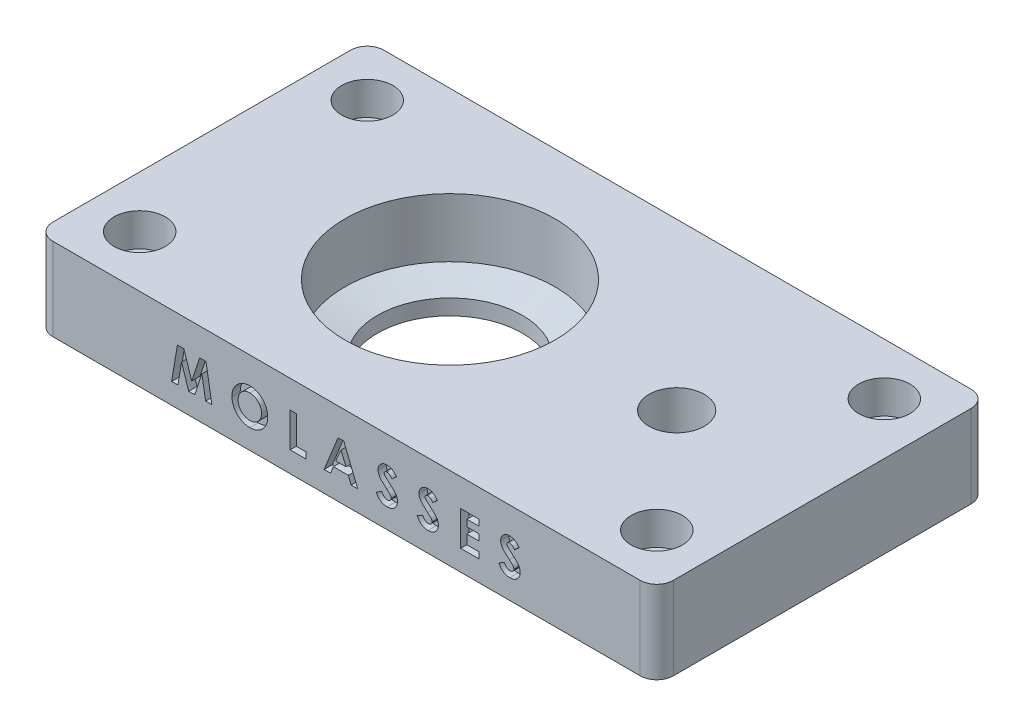
from build123d import *

# Parameters (mm, degrees)
SKETCH1_W           = 95.25
SKETCH1_H           = 50.8
BOSS_EXTRUDE1_DEPTH = 12.7
SKETCH4_R           = 2.54
CUT_EXTRUDE3_DEPTH  = 64.816710194
FILLET2_R           = 2.54
SKETCH8_R           = 4.25
CUT_EXTRUDE4_DEPTH  = 6.35
CUT_EXTRUDE5_DEPTH  = 1.27
SKETCH10_R          = 3.937
CUT_EXTRUDE6_DEPTH  = 5.08


with BuildPart() as part:
    # Sketch1 → Boss-Extrude1 (new body)
    with BuildSketch(Plane(origin=(0, 0, 0), x_dir=(1, 0, 0), z_dir=(0, 1, 0))):
        with Locations((9.525, 0)):
            Rectangle(SKETCH1_W, SKETCH1_H)
    extrude(amount=BOSS_EXTRUDE1_DEPTH)

    # Sketch4 → Cut-Extrude3 (cut, through all)
    with BuildSketch(Plane(origin=(0, 12.7, 0), x_dir=(1, 0, 0), z_dir=(0, 1, 0))):
        with Locations(Location((-30.1625, 17.4625, 0), (0, 0, 270))):
            Circle(SKETCH4_R)
        with Locations(Location((49.2125, 17.4625, 0), (0, 0, 270))):
            Circle(SKETCH4_R)
        with Locations(Location((49.2125, -17.4625, 0), (0, 0, 270))):
            Circle(SKETCH4_R)
        with Locations(Location((-30.1625, -17.4625, 0), (0, 0, 270))):
            Circle(SKETCH4_R)
    extrude(amount=-CUT_EXTRUDE3_DEPTH, mode=Mode.SUBTRACT)

    # Fillet2
    fillet2_edges = [part.edges().sort_by_distance(p)[0] for p in [
        (57.15, 6.35, 25.4),
        (-38.1, 6.35, 25.4),
        (-38.1, 6.35, -25.4),
        (57.15, 6.35, -25.4),
    ]]
    fillet(fillet2_edges, radius=FILLET2_R)

    # Sketch6 → Cut-Revolve1 (revolve, cut)
    with BuildSketch(Plane.XY, mode=Mode.PRIVATE) as cut_revolve1_sk:
        Polygon((0, 0), (0, 12.7), (-16.129, 12.7), (-16.129, 3.65125), (-11.1125, 2.38125), (-11.1125, 0), align=None)
    revolve(cut_revolve1_sk.sketch.rotate(Axis((0, 0, 0), (0, 1, 0)), 180), axis=Axis((0, 0, 0), (0, 1, 0)), mode=Mode.SUBTRACT)

    # Sketch8 → Cut-Extrude4 (cut)
    with BuildSketch(Plane(origin=(0, 12.7, 0), x_dir=(1, 0, 0), z_dir=(0, 1, 0))):
        with Locations(Location((34.798, 0, 0), (0, 0, 270))):
            Circle(SKETCH8_R)
    extrude(amount=-CUT_EXTRUDE4_DEPTH, mode=Mode.SUBTRACT)

    # Sketch9 → Cut-Extrude5 (cut)
    # profile 1 of 8: a face of its own
    with BuildSketch(Plane.XY.offset(25.4)):
        Polygon((-16.429819378, 8.466666667), (-15.443992054, 8.466666667), (-14.23661859, 4.775644364), (-13.02076489, 8.466666667), (-12.044477831, 8.466666667), (-11.149813034, 3.175), (-12.111259682, 3.175), (-12.676255342, 6.517272636), (-13.776565839, 3.175), (-14.703031517, 3.175), (-15.796981838, 6.517272636), (-16.360917468, 3.175), (-17.323424145, 3.175), align=None)
    # profile 2 of 8: a face of its own
    with BuildSketch(Plane.XY.offset(25.4)):
        with BuildLine():
            add(Edge.make_bspline(
                [(-5.304811031, 8.602350427), (-5.212808921, 8.599968328), (-5.031175917, 8.595265524), (-4.764059313, 8.556063985), (-4.506643075, 8.492190696), (-4.259043607, 8.403402205), (-4.021880869, 8.287293668), (-3.794318308, 8.147156839), (-3.577171042, 7.980346718), (-3.372664224, 7.79075471), (-3.18366304, 7.58458168), (-3.019893404, 7.362599759), (-2.880236666, 7.13056072), (-2.764488788, 6.88784281), (-2.676325235, 6.63276509), (-2.614457223, 6.366628119), (-2.574710091, 6.089507612), (-2.570138559, 5.900826319), (-2.567815171, 5.804932893)],
                knots=[0, 0, 0, 0, 1.014329547, 2.002516266, 2.970391464, 3.935626869, 4.897733899, 5.877609409, 6.878433252, 7.912639331, 8.949961323, 9.958554974, 10.949718813, 11.932905612, 12.9188844, 13.919928257, 14.942845884, 16, 16, 16, 16], degree=3))
            add(Edge.make_bspline(
                [(-2.567815171, 5.804932893), (-2.570289479, 5.710119964), (-2.575165181, 5.523288046), (-2.612834571, 5.248721313), (-2.675744448, 4.985435224), (-2.762412678, 4.732833825), (-2.876061327, 4.49214063), (-3.012994607, 4.261818846), (-3.176825925, 4.044005916), (-3.361579711, 3.838818724), (-3.564977596, 3.65256732), (-3.780408245, 3.488433591), (-4.006876932, 3.349352864), (-4.244052181, 3.235388843), (-4.492442601, 3.146945563), (-4.751434637, 3.084542403), (-5.021012265, 3.046618743), (-5.204338124, 3.041774888), (-5.297390825, 3.039316239)],
                knots=[0, 0, 0, 0, 1.051557043, 2.072126891, 3.067553643, 4.050577992, 5.02905126, 6.015227836, 7.017913613, 8.04756643, 9.074058332, 10.072836633, 11.047628519, 12.017157415, 12.98668631, 13.966869689, 14.968021931, 16, 16, 16, 16], degree=3))
            add(Edge.make_bspline(
                [(-5.297390825, 3.039316239), (-5.394712793, 3.041521768), (-5.585937157, 3.04585533), (-5.865794869, 3.087065529), (-6.133922739, 3.149142484), (-6.388068338, 3.241789009), (-6.630819923, 3.357604956), (-6.860393925, 3.500239239), (-7.076713193, 3.669456142), (-7.278536884, 3.860921959), (-7.461389637, 4.070427558), (-7.622793059, 4.291751644), (-7.758940425, 4.523203496), (-7.869836718, 4.764891439), (-7.9572629, 5.015313441), (-8.018932138, 5.275994643), (-8.055361629, 5.546309839), (-8.060436046, 5.729913323), (-8.063007479, 5.822953392)],
                knots=[0, 0, 0, 0, 1.067978421, 2.098431617, 3.099715153, 4.085208694, 5.062210972, 6.048429807, 7.046490867, 8.072918869, 9.098532598, 10.095778865, 11.076610158, 12.041847152, 13.011192615, 13.984257998, 14.978533688, 16, 16, 16, 16], degree=3))
            add(Edge.make_bspline(
                [(-8.063007479, 5.822953392), (-8.062200415, 5.88554588), (-8.060596506, 6.00993829), (-8.041275741, 6.194281493), (-8.013459393, 6.375026564), (-7.972320335, 6.55145287), (-7.922346894, 6.724805016), (-7.857599242, 6.893469398), (-7.783898891, 7.059247816), (-7.697786971, 7.220182218), (-7.602038842, 7.374791873), (-7.497569108, 7.522347462), (-7.384115083, 7.66106482), (-7.262042238, 7.791855542), (-7.130929894, 7.91385993), (-6.992502699, 8.028805127), (-6.844075971, 8.133637779), (-6.688898306, 8.230918109), (-6.527844559, 8.318887024), (-6.361570366, 8.393763534), (-6.193501303, 8.459151915), (-6.021392194, 8.510759316), (-5.847087494, 8.552793004), (-5.668725111, 8.580590604), (-5.487916448, 8.599910834), (-5.365991019, 8.6015353), (-5.304811031, 8.602350427)],
                knots=[0, 0, 0, 0, 1.034744296, 2.056386356, 3.06226378, 4.057406941, 5.050368692, 6.043467995, 7.042652155, 8.049140477, 9.059438543, 10.048523776, 11.036952808, 12.020949711, 13.004946614, 13.997082645, 14.994316842, 16.007702937, 17.024872941, 18.026463647, 19.021641123, 20.005082605, 20.995858141, 21.984425357, 22.988620895, 24, 24, 24, 24], degree=3))
        make_face()
        with BuildLine():
            add(Edge.make_bspline(
                [(-5.319651442, 7.652564103), (-5.38156885, 7.650902719), (-5.503769037, 7.647623814), (-5.683014455, 7.62264299), (-5.855096388, 7.582745774), (-6.019060915, 7.524955145), (-6.175618674, 7.451402342), (-6.325047193, 7.362344366), (-6.465277196, 7.25471995), (-6.598178514, 7.134306969), (-6.718232986, 7.000139235), (-6.824304899, 6.85635569), (-6.913070006, 6.703196451), (-6.987411339, 6.542084331), (-7.043373886, 6.371207667), (-7.083234331, 6.191904953), (-7.108424644, 6.003867243), (-7.111599914, 5.87568218), (-7.113221154, 5.81023304)],
                knots=[0, 0, 0, 0, 1.033739768, 2.040188636, 3.016340934, 3.979330865, 4.937572243, 5.900995986, 6.878200029, 7.884839167, 8.891893314, 9.879764717, 10.863503415, 11.843163062, 12.837761627, 13.859916423, 14.907309254, 16, 16, 16, 16], degree=3))
            add(Edge.make_bspline(
                [(-7.113221154, 5.81023304), (-7.111071638, 5.737700669), (-7.106858942, 5.595549241), (-7.077217902, 5.388182567), (-7.026505033, 5.192345325), (-6.953276636, 5.008995325), (-6.862454212, 4.836096603), (-6.749667176, 4.675768278), (-6.616742144, 4.527050379), (-6.514337777, 4.440222675), (-6.462363114, 4.396153846)],
                knots=[0, 0, 0, 0, 1.078454662, 2.113592447, 3.107694534, 4.079536787, 5.043276885, 6.005368276, 6.987637804, 8, 8, 8, 8], degree=3))
            add(Edge.make_bspline(
                [(-6.462363114, 4.396153846), (-6.419785943, 4.363597488), (-6.335590872, 4.299218271), (-6.201197207, 4.216703098), (-6.062798196, 4.145979363), (-5.919349444, 4.088835422), (-5.771153908, 4.043886959), (-5.61823191, 4.012410289), (-5.460800128, 3.992655956), (-5.354337378, 3.990294939), (-5.300570913, 3.989102564)],
                knots=[0, 0, 0, 0, 1.023928204, 2.024787132, 3.009472467, 3.9914905, 4.972207045, 5.96565515, 6.972602802, 8, 8, 8, 8], degree=3))
            add(Edge.make_bspline(
                [(-5.300570913, 3.989102564), (-5.239718177, 3.990778034), (-5.119988503, 3.994074573), (-4.944079835, 4.01874787), (-4.775553988, 4.060503996), (-4.613364739, 4.117787665), (-4.45797977, 4.192263988), (-4.31015849, 4.284084263), (-4.169641728, 4.392121054), (-4.036909724, 4.514115322), (-3.915586398, 4.648811584), (-3.809735835, 4.793362055), (-3.718148441, 4.944581855), (-3.645353037, 5.104611272), (-3.587179536, 5.271939703), (-3.547798833, 5.447308209), (-3.522395719, 5.629993855), (-3.519219554, 5.754317893), (-3.517601496, 5.817653245)],
                knots=[0, 0, 0, 0, 1.026359118, 2.019393844, 2.989460624, 3.950973911, 4.916101784, 5.890408035, 6.881132271, 7.902007068, 8.92769091, 9.933912415, 10.920395702, 11.90457117, 12.894218921, 13.903490204, 14.931958862, 16, 16, 16, 16], degree=3))
            add(Edge.make_bspline(
                [(-3.517601496, 5.817653245), (-3.519275539, 5.880624402), (-3.522570638, 6.00457352), (-3.547287361, 6.186789482), (-3.58877868, 6.361383788), (-3.646234366, 6.528641568), (-3.719602235, 6.688726796), (-3.810329048, 6.841076519), (-3.918096455, 6.985543452), (-4.040424197, 7.121143108), (-4.173570426, 7.245750506), (-4.316516207, 7.353887076), (-4.465261755, 7.447854317), (-4.623220021, 7.521464459), (-4.78715931, 7.580109503), (-4.958079987, 7.623296555), (-5.136629427, 7.647448323), (-5.258100303, 7.650843642), (-5.319651442, 7.652564103)],
                knots=[0, 0, 0, 0, 1.055025985, 2.07665775, 3.074803781, 4.057872707, 5.035505728, 6.020516407, 7.023567878, 8.050795229, 9.077271434, 10.074415901, 11.050397877, 12.019801805, 12.988065821, 13.964604439, 14.968634123, 16, 16, 16, 16], degree=3))
        make_face(mode=Mode.SUBTRACT)
    # profile 3 of 8: a face of its own
    with BuildSketch(Plane.XY.offset(25.4)):
        Polygon((0.858199786, 8.466666667), (1.807986111, 8.466666667), (1.807986111, 4.124786325), (3.300507479, 4.124786325), (3.300507479, 3.175), (0.858199786, 3.175), align=None)
    # profile 4 of 8: a face of its own
    with BuildSketch(Plane.XY.offset(25.4)):
        Polygon((8.220103833, 8.466666667), (9.100988248, 8.466666667), (11.238007479, 3.175), (10.223559362, 3.175), (9.812267962, 4.260470085), (7.50670406, 4.260470085), (7.09541266, 3.175), (6.082024573, 3.175), align=None)
        Polygon((8.660016026, 7.047287326), (7.867114049, 5.21025641), (9.452918002, 5.21025641), align=None, mode=Mode.SUBTRACT)
    # profile 5 of 8: a face of its own
    with BuildSketch(Plane.XY.offset(25.4)):
        with BuildLine():
            Line((17.208092949, 7.75962707), (16.497873264, 7.10982906))
            add(Edge.make_bspline(
                [(16.497873264, 7.10982906), (16.467450498, 7.152743534), (16.40904303, 7.23513334), (16.314370616, 7.345455231), (16.220125697, 7.439568015), (16.125435151, 7.517078531), (16.029459676, 7.577515845), (15.932365872, 7.620306131), (15.834704191, 7.647508322), (15.769090617, 7.65089565), (15.736772169, 7.652564103)],
                knots=[0, 0, 0, 0, 1.299362458, 2.494594718, 3.587462134, 4.587049575, 5.512617175, 6.380583204, 7.202344345, 8, 8, 8, 8], degree=3))
            add(Edge.make_bspline(
                [(15.736772169, 7.652564103), (15.706626447, 7.651506894), (15.648422979, 7.649465703), (15.565449616, 7.629176411), (15.491784683, 7.594160073), (15.427500074, 7.548373266), (15.376577179, 7.493210778), (15.335919196, 7.435359512), (15.313025335, 7.371504798), (15.310012053, 7.327646804), (15.308520299, 7.305934495)],
                knots=[0, 0, 0, 0, 1.185010067, 2.2879431, 3.333075148, 4.379039566, 5.372662701, 6.27520591, 7.14612461, 8, 8, 8, 8], degree=3))
            add(Edge.make_bspline(
                [(15.308520299, 7.305934495), (15.309455106, 7.283909085), (15.311337676, 7.239552971), (15.32952074, 7.174543561), (15.35692781, 7.1110218), (15.383116385, 7.072353082), (15.396502738, 7.052587473)],
                knots=[0, 0, 0, 0, 0.967525499, 1.948461899, 2.951351359, 4, 4, 4, 4], degree=3))
            add(Edge.make_bspline(
                [(15.396502738, 7.052587473), (15.408672381, 7.037223873), (15.436685291, 7.001858893), (15.490100175, 6.945846277), (15.55717805, 6.87722592), (15.640500215, 6.798357475), (15.736607739, 6.706404524), (15.849955327, 6.604981772), (15.977280343, 6.490948275), (16.067780015, 6.411539477), (16.115202658, 6.369928552)],
                knots=[0, 0, 0, 0, 0.473873513, 1.090794244, 1.870441696, 2.795289791, 3.865433203, 5.087734844, 6.473946851, 8, 8, 8, 8], degree=3))
            add(Edge.make_bspline(
                [(16.115202658, 6.369928552), (16.159715629, 6.331404821), (16.244192001, 6.258294782), (16.364385103, 6.15452682), (16.470014822, 6.061169315), (16.562619941, 5.979623363), (16.640796658, 5.90903336), (16.704873627, 5.849061888), (16.755633441, 5.80087648), (16.784487423, 5.771772464), (16.796801549, 5.759351629)],
                knots=[0, 0, 0, 0, 1.543621617, 2.929473131, 4.163658386, 5.240097082, 6.164993805, 6.925417477, 7.541396219, 8, 8, 8, 8], degree=3))
            add(Edge.make_bspline(
                [(16.796801549, 5.759351629), (16.843518778, 5.708793582), (16.933325698, 5.611603261), (17.050043036, 5.460988828), (17.14610518, 5.313958431), (17.220420676, 5.167745453), (17.276546728, 5.020240334), (17.316116338, 4.867825517), (17.339814841, 4.708908364), (17.342445928, 4.600466807), (17.343776709, 4.545617989)],
                knots=[0, 0, 0, 0, 1.206664779, 2.319633467, 3.337109185, 4.282041471, 5.190008762, 6.099243693, 7.03861361, 8, 8, 8, 8], degree=3))
            add(Edge.make_bspline(
                [(17.343776709, 4.545617989), (17.342829493, 4.492174542), (17.34097102, 4.387316511), (17.318208284, 4.233872401), (17.285749959, 4.087019728), (17.235563695, 3.948356457), (17.174396972, 3.815606473), (17.097715652, 3.690837598), (17.007663956, 3.57278712), (16.904450885, 3.463565336), (16.790284973, 3.364454137), (16.667831182, 3.276223007), (16.535892098, 3.20337697), (16.395594987, 3.143393455), (16.247014947, 3.09719335), (16.090328981, 3.063047167), (15.925297428, 3.042553165), (15.812446474, 3.040410761), (15.754792668, 3.039316239)],
                knots=[0, 0, 0, 0, 1.043214005, 2.046824704, 3.02475056, 3.976699089, 4.921714032, 5.875962561, 6.831408892, 7.817874052, 8.806269674, 9.781291748, 10.760897367, 11.74438705, 12.757449933, 13.795994037, 14.874007457, 16, 16, 16, 16], degree=3))
            add(Edge.make_bspline(
                [(15.754792668, 3.039316239), (15.709534921, 3.040119142), (15.619898627, 3.041709349), (15.487788281, 3.054692071), (15.360220808, 3.075644801), (15.2373399, 3.105676324), (15.118591959, 3.143730335), (15.003972106, 3.190211853), (14.894271602, 3.245841323), (14.788660399, 3.309474781), (14.687651899, 3.383361609), (14.589968889, 3.465991213), (14.49658165, 3.558634474), (14.40704166, 3.661072295), (14.321921823, 3.773594754), (14.238435861, 3.894634769), (14.16029414, 4.026438677), (14.112022523, 4.118900185), (14.087366453, 4.166127471)],
                knots=[0, 0, 0, 0, 1.016823716, 2.013894106, 2.979844003, 3.91962641, 4.853723003, 5.779685073, 6.695824784, 7.614987388, 8.547259901, 9.504950863, 10.487499108, 11.500346958, 12.559593716, 13.656357062, 14.802919212, 16, 16, 16, 16], degree=3))
            Line((14.087366453, 4.166127471), (14.922669605, 4.667521368))
            add(Edge.make_bspline(
                [(14.922669605, 4.667521368), (14.953510664, 4.613912228), (15.012635609, 4.511138925), (15.112828358, 4.373049966), (15.215470713, 4.254799632), (15.322935675, 4.158478003), (15.43391651, 4.082797135), (15.548949281, 4.028710337), (15.668114808, 3.99523067), (15.749284952, 3.991142029), (15.789773638, 3.989102564)],
                knots=[0, 0, 0, 0, 1.283663364, 2.460892379, 3.537111102, 4.529833553, 5.449777664, 6.316464042, 7.160231139, 8, 8, 8, 8], degree=3))
            add(Edge.make_bspline(
                [(15.789773638, 3.989102564), (15.830956428, 3.990768102), (15.910857039, 3.993999488), (16.024904937, 4.023846827), (16.129468369, 4.070709339), (16.219852226, 4.137575682), (16.296383578, 4.214749604), (16.352868109, 4.300609121), (16.388352072, 4.393507046), (16.392103587, 4.458040055), (16.393990385, 4.490496461)],
                knots=[0, 0, 0, 0, 1.13588714, 2.203786484, 3.234766741, 4.283437687, 5.291419208, 6.222934724, 7.106237994, 8, 8, 8, 8], degree=3))
            add(Edge.make_bspline(
                [(16.393990385, 4.490496461), (16.392248005, 4.520691865), (16.388708527, 4.582030938), (16.362637822, 4.673232275), (16.321881358, 4.764392136), (16.273663587, 4.83916392), (16.224595968, 4.901768309), (16.177676257, 4.956012179), (16.12054046, 5.015942159), (16.05333345, 5.081633637), (15.976943205, 5.153664911), (15.891305377, 5.232028927), (15.795439323, 5.316035393), (15.727681006, 5.373259767), (15.692250935, 5.403181757)],
                knots=[0, 0, 0, 0, 0.916159276, 1.861089862, 2.860218735, 3.940849679, 4.552606315, 5.27541173, 6.11797699, 7.06649574, 8.129236253, 9.306560635, 10.591630461, 12, 12, 12, 12], degree=3))
            add(Edge.make_bspline(
                [(15.692250935, 5.403181757), (15.624896959, 5.46016968), (15.495624293, 5.569546752), (15.312945614, 5.731093244), (15.148335768, 5.882073243), (15.003216502, 6.024353192), (14.875738771, 6.15530551), (14.766765911, 6.275993842), (14.677495038, 6.387349133), (14.583556693, 6.519242024), (14.494296483, 6.679962574), (14.417150332, 6.873328027), (14.367101166, 7.066668945), (14.361493853, 7.196467388), (14.358733974, 7.260353232)],
                knots=[0, 0, 0, 0, 1.345494975, 2.582412109, 3.71882943, 4.751509156, 5.681369928, 6.505683931, 7.230279997, 7.856715994, 8.973648664, 10.023341002, 11.027102913, 12, 12, 12, 12], degree=3))
            add(Edge.make_bspline(
                [(14.358733974, 7.260353232), (14.359881804, 7.305657643), (14.362143152, 7.3949122), (14.382314724, 7.52614802), (14.412461908, 7.652779561), (14.456244273, 7.774344811), (14.513068496, 7.890691505), (14.582079308, 8.00238921), (14.664348316, 8.108409885), (14.757059934, 8.208683246), (14.8592044, 8.300321687), (14.968358743, 8.381201793), (15.083905139, 8.449514307), (15.205136734, 8.506184498), (15.33280475, 8.549561929), (15.465968662, 8.580310014), (15.60481947, 8.598597994), (15.699262793, 8.601084033), (15.747372463, 8.602350427)],
                knots=[0, 0, 0, 0, 1.010766082, 1.991317756, 2.957454644, 3.913069143, 4.869106762, 5.843196583, 6.838735724, 7.860187025, 8.887984031, 9.89767229, 10.887916223, 11.879572884, 12.879850636, 13.892031539, 14.926195476, 16, 16, 16, 16], degree=3))
            add(Edge.make_bspline(
                [(15.747372463, 8.602350427), (15.809720214, 8.600069614), (15.933923565, 8.595525991), (16.117561801, 8.559996342), (16.296931953, 8.504122227), (16.441471782, 8.436716254), (16.556479427, 8.371420057), (16.644622043, 8.311303543), (16.7343119, 8.242436846), (16.82627229, 8.164602948), (16.918794446, 8.076335356), (17.014509217, 7.97973535), (17.112112371, 7.87396808), (17.175538946, 7.798408432), (17.208092949, 7.75962707)],
                knots=[0, 0, 0, 0, 1.282922637, 2.555718331, 3.837320111, 5.142675274, 5.830281639, 6.55870424, 7.337177975, 8.157850921, 9.037902056, 9.96903443, 10.957596896, 12, 12, 12, 12], degree=3))
        make_face()
    # profile 6 of 8: a face of its own
    with BuildSketch(Plane.XY.offset(25.4)):
        with BuildLine():
            Line((23.48346688, 7.75962707), (22.773247196, 7.10982906))
            add(Edge.make_bspline(
                [(22.773247196, 7.10982906), (22.74282443, 7.152743534), (22.684416962, 7.23513334), (22.589744548, 7.345455231), (22.495499629, 7.439568015), (22.400809082, 7.517078531), (22.304833608, 7.577515845), (22.207739804, 7.620306131), (22.110078123, 7.647508322), (22.044464549, 7.65089565), (22.0121461, 7.652564103)],
                knots=[0, 0, 0, 0, 1.299362458, 2.494594718, 3.587462134, 4.587049575, 5.512617175, 6.380583204, 7.202344345, 8, 8, 8, 8], degree=3))
            add(Edge.make_bspline(
                [(22.0121461, 7.652564103), (21.982000379, 7.651506894), (21.92379691, 7.649465703), (21.840823548, 7.629176411), (21.767158615, 7.594160073), (21.702874006, 7.548373266), (21.65195111, 7.493210778), (21.611293128, 7.435359512), (21.588399267, 7.371504798), (21.585385984, 7.327646804), (21.583894231, 7.305934495)],
                knots=[0, 0, 0, 0, 1.185010067, 2.2879431, 3.333075148, 4.379039566, 5.372662701, 6.27520591, 7.14612461, 8, 8, 8, 8], degree=3))
            add(Edge.make_bspline(
                [(21.583894231, 7.305934495), (21.584829037, 7.283909085), (21.586711607, 7.239552971), (21.604894672, 7.174543561), (21.632301742, 7.1110218), (21.658490316, 7.072353082), (21.671876669, 7.052587473)],
                knots=[0, 0, 0, 0, 0.967525499, 1.948461899, 2.951351359, 4, 4, 4, 4], degree=3))
            add(Edge.make_bspline(
                [(21.671876669, 7.052587473), (21.684046312, 7.037223873), (21.712059223, 7.001858893), (21.765474106, 6.945846277), (21.832551982, 6.87722592), (21.915874147, 6.798357475), (22.01198167, 6.706404524), (22.125329259, 6.604981772), (22.252654275, 6.490948275), (22.343153947, 6.411539477), (22.390576589, 6.369928552)],
                knots=[0, 0, 0, 0, 0.473873513, 1.090794244, 1.870441696, 2.795289791, 3.865433203, 5.087734844, 6.473946851, 8, 8, 8, 8], degree=3))
            add(Edge.make_bspline(
                [(22.390576589, 6.369928552), (22.435089561, 6.331404821), (22.519565933, 6.258294782), (22.639759035, 6.15452682), (22.745388754, 6.061169315), (22.837993873, 5.979623363), (22.91617059, 5.90903336), (22.980247559, 5.849061888), (23.031007372, 5.80087648), (23.059861354, 5.771772464), (23.072175481, 5.759351629)],
                knots=[0, 0, 0, 0, 1.543621617, 2.929473131, 4.163658386, 5.240097082, 6.164993805, 6.925417477, 7.541396219, 8, 8, 8, 8], degree=3))
            add(Edge.make_bspline(
                [(23.072175481, 5.759351629), (23.11889271, 5.708793582), (23.20869963, 5.611603261), (23.325416967, 5.460988828), (23.421479112, 5.313958431), (23.495794608, 5.167745453), (23.55192066, 5.020240334), (23.59149027, 4.867825517), (23.615188772, 4.708908364), (23.61781986, 4.600466807), (23.619150641, 4.545617989)],
                knots=[0, 0, 0, 0, 1.206664779, 2.319633467, 3.337109185, 4.282041471, 5.190008762, 6.099243693, 7.03861361, 8, 8, 8, 8], degree=3))
            add(Edge.make_bspline(
                [(23.619150641, 4.545617989), (23.618203425, 4.492174542), (23.616344951, 4.387316511), (23.593582216, 4.233872401), (23.561123891, 4.087019728), (23.510937626, 3.948356457), (23.449770904, 3.815606473), (23.373089584, 3.690837598), (23.283037888, 3.57278712), (23.179824817, 3.463565336), (23.065658905, 3.364454137), (22.943205114, 3.276223007), (22.81126603, 3.20337697), (22.670968918, 3.143393455), (22.522388878, 3.09719335), (22.365702913, 3.063047167), (22.20067136, 3.042553165), (22.087820406, 3.040410761), (22.0301666, 3.039316239)],
                knots=[0, 0, 0, 0, 1.043214005, 2.046824704, 3.02475056, 3.976699089, 4.921714032, 5.875962561, 6.831408892, 7.817874052, 8.806269674, 9.781291748, 10.760897367, 11.74438705, 12.757449933, 13.795994037, 14.874007457, 16, 16, 16, 16], degree=3))
            add(Edge.make_bspline(
                [(22.0301666, 3.039316239), (21.984908853, 3.040119142), (21.895272559, 3.041709349), (21.763162213, 3.054692071), (21.635594739, 3.075644801), (21.512713832, 3.105676324), (21.39396589, 3.143730335), (21.279346038, 3.190211853), (21.169645533, 3.245841323), (21.064034331, 3.309474781), (20.963025831, 3.383361609), (20.865342821, 3.465991213), (20.771955581, 3.558634474), (20.682415592, 3.661072295), (20.597295755, 3.773594754), (20.513809792, 3.894634769), (20.435668072, 4.026438677), (20.387396455, 4.118900185), (20.362740385, 4.166127471)],
                knots=[0, 0, 0, 0, 1.016823716, 2.013894106, 2.979844003, 3.91962641, 4.853723003, 5.779685073, 6.695824784, 7.614987388, 8.547259901, 9.504950863, 10.487499108, 11.500346958, 12.559593716, 13.656357062, 14.802919212, 16, 16, 16, 16], degree=3))
            Line((20.362740385, 4.166127471), (21.198043536, 4.667521368))
            add(Edge.make_bspline(
                [(21.198043536, 4.667521368), (21.228884595, 4.613912228), (21.288009541, 4.511138925), (21.388202289, 4.373049966), (21.490844645, 4.254799632), (21.598309607, 4.158478003), (21.709290442, 4.082797135), (21.824323213, 4.028710337), (21.94348874, 3.99523067), (22.024658883, 3.991142029), (22.065147569, 3.989102564)],
                knots=[0, 0, 0, 0, 1.283663364, 2.460892379, 3.537111102, 4.529833553, 5.449777664, 6.316464042, 7.160231139, 8, 8, 8, 8], degree=3))
            add(Edge.make_bspline(
                [(22.065147569, 3.989102564), (22.10633036, 3.990768102), (22.186230971, 3.993999488), (22.300278869, 4.023846827), (22.4048423, 4.070709339), (22.495226158, 4.137575682), (22.57175751, 4.214749604), (22.628242041, 4.300609121), (22.663726004, 4.393507046), (22.667477519, 4.458040055), (22.669364316, 4.490496461)],
                knots=[0, 0, 0, 0, 1.13588714, 2.203786484, 3.234766741, 4.283437687, 5.291419208, 6.222934724, 7.106237994, 8, 8, 8, 8], degree=3))
            add(Edge.make_bspline(
                [(22.669364316, 4.490496461), (22.667621936, 4.520691865), (22.664082458, 4.582030938), (22.638011753, 4.673232275), (22.59725529, 4.764392136), (22.549037519, 4.83916392), (22.4999699, 4.901768309), (22.453050189, 4.956012179), (22.395914392, 5.015942159), (22.328707381, 5.081633637), (22.252317137, 5.153664911), (22.166679309, 5.232028927), (22.070813254, 5.316035393), (22.003054938, 5.373259767), (21.967624866, 5.403181757)],
                knots=[0, 0, 0, 0, 0.916159276, 1.861089862, 2.860218735, 3.940849679, 4.552606315, 5.27541173, 6.11797699, 7.06649574, 8.129236253, 9.306560635, 10.591630461, 12, 12, 12, 12], degree=3))
            add(Edge.make_bspline(
                [(21.967624866, 5.403181757), (21.900270891, 5.46016968), (21.770998224, 5.569546752), (21.588319546, 5.731093244), (21.4237097, 5.882073243), (21.278590433, 6.024353192), (21.151112703, 6.15530551), (21.042139843, 6.275993842), (20.952868969, 6.387349133), (20.858930624, 6.519242024), (20.769670415, 6.679962574), (20.692524264, 6.873328027), (20.642475097, 7.066668945), (20.636867784, 7.196467388), (20.634107906, 7.260353232)],
                knots=[0, 0, 0, 0, 1.345494975, 2.582412109, 3.71882943, 4.751509156, 5.681369928, 6.505683931, 7.230279997, 7.856715994, 8.973648664, 10.023341002, 11.027102913, 12, 12, 12, 12], degree=3))
            add(Edge.make_bspline(
                [(20.634107906, 7.260353232), (20.635255736, 7.305657643), (20.637517084, 7.3949122), (20.657688656, 7.52614802), (20.687835839, 7.652779561), (20.731618204, 7.774344811), (20.788442428, 7.890691505), (20.85745324, 8.00238921), (20.939722248, 8.108409885), (21.032433865, 8.208683246), (21.134578332, 8.300321687), (21.243732674, 8.381201793), (21.35927907, 8.449514307), (21.480510666, 8.506184498), (21.608178681, 8.549561929), (21.741342594, 8.580310014), (21.880193402, 8.598597994), (21.974636724, 8.601084033), (22.022746394, 8.602350427)],
                knots=[0, 0, 0, 0, 1.010766082, 1.991317756, 2.957454644, 3.913069143, 4.869106762, 5.843196583, 6.838735724, 7.860187025, 8.887984031, 9.89767229, 10.887916223, 11.879572884, 12.879850636, 13.892031539, 14.926195476, 16, 16, 16, 16], degree=3))
            add(Edge.make_bspline(
                [(22.022746394, 8.602350427), (22.085094145, 8.600069614), (22.209297496, 8.595525991), (22.392935733, 8.559996342), (22.572305884, 8.504122227), (22.716845714, 8.436716254), (22.831853359, 8.371420057), (22.919995975, 8.311303543), (23.009685831, 8.242436846), (23.101646221, 8.164602948), (23.194168378, 8.076335356), (23.289883149, 7.97973535), (23.387486303, 7.87396808), (23.450912878, 7.798408432), (23.48346688, 7.75962707)],
                knots=[0, 0, 0, 0, 1.282922637, 2.555718331, 3.837320111, 5.142675274, 5.830281639, 6.55870424, 7.337177975, 8.157850921, 9.037902056, 9.96903443, 10.957596896, 12, 12, 12, 12], degree=3))
        make_face()
    # profile 7 of 8: a face of its own
    with BuildSketch(Plane.XY.offset(25.4)):
        Polygon((27.045165598, 8.466666667), (29.894524573, 8.466666667), (29.894524573, 7.516880342), (27.994951923, 7.516880342), (27.994951923, 6.499252137), (29.894524573, 6.499252137), (29.894524573, 5.549465812), (27.994951923, 5.549465812), (27.994951923, 4.124786325), (29.894524573, 4.124786325), (29.894524573, 3.175), (27.045165598, 3.175), align=None)
    # profile 8 of 8: a face of its own
    with BuildSketch(Plane.XY.offset(25.4)):
        with BuildLine():
            Line((36.034214744, 7.75962707), (35.323995059, 7.10982906))
            add(Edge.make_bspline(
                [(35.323995059, 7.10982906), (35.293572293, 7.152743534), (35.235164825, 7.23513334), (35.140492411, 7.345455231), (35.046247492, 7.439568015), (34.951556946, 7.517078531), (34.855581471, 7.577515845), (34.758487667, 7.620306131), (34.660825986, 7.647508322), (34.595212412, 7.65089565), (34.562893964, 7.652564103)],
                knots=[0, 0, 0, 0, 1.299362458, 2.494594718, 3.587462134, 4.587049575, 5.512617175, 6.380583204, 7.202344345, 8, 8, 8, 8], degree=3))
            add(Edge.make_bspline(
                [(34.562893964, 7.652564103), (34.532748242, 7.651506894), (34.474544773, 7.649465703), (34.391571411, 7.629176411), (34.317906478, 7.594160073), (34.253621869, 7.548373266), (34.202698974, 7.493210778), (34.162040991, 7.435359512), (34.13914713, 7.371504798), (34.136133848, 7.327646804), (34.134642094, 7.305934495)],
                knots=[0, 0, 0, 0, 1.185010067, 2.2879431, 3.333075148, 4.379039566, 5.372662701, 6.27520591, 7.14612461, 8, 8, 8, 8], degree=3))
            add(Edge.make_bspline(
                [(34.134642094, 7.305934495), (34.1355769, 7.283909085), (34.13745947, 7.239552971), (34.155642535, 7.174543561), (34.183049605, 7.1110218), (34.20923818, 7.072353082), (34.222624533, 7.052587473)],
                knots=[0, 0, 0, 0, 0.967525499, 1.948461899, 2.951351359, 4, 4, 4, 4], degree=3))
            add(Edge.make_bspline(
                [(34.222624533, 7.052587473), (34.234794175, 7.037223873), (34.262807086, 7.001858893), (34.31622197, 6.945846277), (34.383299845, 6.87722592), (34.46662201, 6.798357475), (34.562729533, 6.706404524), (34.676077122, 6.604981772), (34.803402138, 6.490948275), (34.89390181, 6.411539477), (34.941324452, 6.369928552)],
                knots=[0, 0, 0, 0, 0.473873513, 1.090794244, 1.870441696, 2.795289791, 3.865433203, 5.087734844, 6.473946851, 8, 8, 8, 8], degree=3))
            add(Edge.make_bspline(
                [(34.941324452, 6.369928552), (34.985837424, 6.331404821), (35.070313796, 6.258294782), (35.190506898, 6.15452682), (35.296136617, 6.061169315), (35.388741736, 5.979623363), (35.466918453, 5.90903336), (35.530995422, 5.849061888), (35.581755236, 5.80087648), (35.610609217, 5.771772464), (35.622923344, 5.759351629)],
                knots=[0, 0, 0, 0, 1.543621617, 2.929473131, 4.163658386, 5.240097082, 6.164993805, 6.925417477, 7.541396219, 8, 8, 8, 8], degree=3))
            add(Edge.make_bspline(
                [(35.622923344, 5.759351629), (35.669640573, 5.708793582), (35.759447493, 5.611603261), (35.876164831, 5.460988828), (35.972226975, 5.313958431), (36.046542471, 5.167745453), (36.102668523, 5.020240334), (36.142238133, 4.867825517), (36.165936636, 4.708908364), (36.168567723, 4.600466807), (36.169898504, 4.545617989)],
                knots=[0, 0, 0, 0, 1.206664779, 2.319633467, 3.337109185, 4.282041471, 5.190008762, 6.099243693, 7.03861361, 8, 8, 8, 8], degree=3))
            add(Edge.make_bspline(
                [(36.169898504, 4.545617989), (36.168951288, 4.492174542), (36.167092815, 4.387316511), (36.144330079, 4.233872401), (36.111871754, 4.087019728), (36.061685489, 3.948356457), (36.000518767, 3.815606473), (35.923837447, 3.690837598), (35.833785751, 3.57278712), (35.73057268, 3.463565336), (35.616406768, 3.364454137), (35.493952977, 3.276223007), (35.362013893, 3.20337697), (35.221716782, 3.143393455), (35.073136741, 3.09719335), (34.916450776, 3.063047167), (34.751419223, 3.042553165), (34.638568269, 3.040410761), (34.580914463, 3.039316239)],
                knots=[0, 0, 0, 0, 1.043214005, 2.046824704, 3.02475056, 3.976699089, 4.921714032, 5.875962561, 6.831408892, 7.817874052, 8.806269674, 9.781291748, 10.760897367, 11.74438705, 12.757449933, 13.795994037, 14.874007457, 16, 16, 16, 16], degree=3))
            add(Edge.make_bspline(
                [(34.580914463, 3.039316239), (34.535656716, 3.040119142), (34.446020422, 3.041709349), (34.313910076, 3.054692071), (34.186342603, 3.075644801), (34.063461695, 3.105676324), (33.944713754, 3.143730335), (33.830093901, 3.190211853), (33.720393397, 3.245841323), (33.614782194, 3.309474781), (33.513773694, 3.383361609), (33.416090684, 3.465991213), (33.322703445, 3.558634474), (33.233163455, 3.661072295), (33.148043618, 3.773594754), (33.064557656, 3.894634769), (32.986415935, 4.026438677), (32.938144318, 4.118900185), (32.913488248, 4.166127471)],
                knots=[0, 0, 0, 0, 1.016823716, 2.013894106, 2.979844003, 3.91962641, 4.853723003, 5.779685073, 6.695824784, 7.614987388, 8.547259901, 9.504950863, 10.487499108, 11.500346958, 12.559593716, 13.656357062, 14.802919212, 16, 16, 16, 16], degree=3))
            Line((32.913488248, 4.166127471), (33.7487914, 4.667521368))
            add(Edge.make_bspline(
                [(33.7487914, 4.667521368), (33.779632459, 4.613912228), (33.838757404, 4.511138925), (33.938950152, 4.373049966), (34.041592508, 4.254799632), (34.14905747, 4.158478003), (34.260038305, 4.082797135), (34.375071076, 4.028710337), (34.494236603, 3.99523067), (34.575406747, 3.991142029), (34.615895433, 3.989102564)],
                knots=[0, 0, 0, 0, 1.283663364, 2.460892379, 3.537111102, 4.529833553, 5.449777664, 6.316464042, 7.160231139, 8, 8, 8, 8], degree=3))
            add(Edge.make_bspline(
                [(34.615895433, 3.989102564), (34.657078223, 3.990768102), (34.736978834, 3.993999488), (34.851026732, 4.023846827), (34.955590164, 4.070709339), (35.045974021, 4.137575682), (35.122505373, 4.214749604), (35.178989904, 4.300609121), (35.214473867, 4.393507046), (35.218225382, 4.458040055), (35.220112179, 4.490496461)],
                knots=[0, 0, 0, 0, 1.13588714, 2.203786484, 3.234766741, 4.283437687, 5.291419208, 6.222934724, 7.106237994, 8, 8, 8, 8], degree=3))
            add(Edge.make_bspline(
                [(35.220112179, 4.490496461), (35.2183698, 4.520691865), (35.214830321, 4.582030938), (35.188759617, 4.673232275), (35.148003153, 4.764392136), (35.099785382, 4.83916392), (35.050717763, 4.901768309), (35.003798052, 4.956012179), (34.946662255, 5.015942159), (34.879455245, 5.081633637), (34.803065, 5.153664911), (34.717427172, 5.232028927), (34.621561118, 5.316035393), (34.553802801, 5.373259767), (34.51837273, 5.403181757)],
                knots=[0, 0, 0, 0, 0.916159276, 1.861089862, 2.860218735, 3.940849679, 4.552606315, 5.27541173, 6.11797699, 7.06649574, 8.129236253, 9.306560635, 10.591630461, 12, 12, 12, 12], degree=3))
            add(Edge.make_bspline(
                [(34.51837273, 5.403181757), (34.451018754, 5.46016968), (34.321746088, 5.569546752), (34.139067409, 5.731093244), (33.974457563, 5.882073243), (33.829338297, 6.024353192), (33.701860566, 6.15530551), (33.592887706, 6.275993842), (33.503616833, 6.387349133), (33.409678488, 6.519242024), (33.320418278, 6.679962574), (33.243272127, 6.873328027), (33.193222961, 7.066668945), (33.187615648, 7.196467388), (33.184855769, 7.260353232)],
                knots=[0, 0, 0, 0, 1.345494975, 2.582412109, 3.71882943, 4.751509156, 5.681369928, 6.505683931, 7.230279997, 7.856715994, 8.973648664, 10.023341002, 11.027102913, 12, 12, 12, 12], degree=3))
            add(Edge.make_bspline(
                [(33.184855769, 7.260353232), (33.186003599, 7.305657643), (33.188264947, 7.3949122), (33.208436519, 7.52614802), (33.238583702, 7.652779561), (33.282366067, 7.774344811), (33.339190291, 7.890691505), (33.408201103, 8.00238921), (33.490470111, 8.108409885), (33.583181729, 8.208683246), (33.685326195, 8.300321687), (33.794480537, 8.381201793), (33.910026934, 8.449514307), (34.031258529, 8.506184498), (34.158926545, 8.549561929), (34.292090457, 8.580310014), (34.430941265, 8.598597994), (34.525384588, 8.601084033), (34.573494257, 8.602350427)],
                knots=[0, 0, 0, 0, 1.010766082, 1.991317756, 2.957454644, 3.913069143, 4.869106762, 5.843196583, 6.838735724, 7.860187025, 8.887984031, 9.89767229, 10.887916223, 11.879572884, 12.879850636, 13.892031539, 14.926195476, 16, 16, 16, 16], degree=3))
            add(Edge.make_bspline(
                [(34.573494257, 8.602350427), (34.635842009, 8.600069614), (34.760045359, 8.595525991), (34.943683596, 8.559996342), (35.123053748, 8.504122227), (35.267593577, 8.436716254), (35.382601222, 8.371420057), (35.470743838, 8.311303543), (35.560433695, 8.242436846), (35.652394085, 8.164602948), (35.744916241, 8.076335356), (35.840631012, 7.97973535), (35.938234166, 7.87396808), (36.001660741, 7.798408432), (36.034214744, 7.75962707)],
                knots=[0, 0, 0, 0, 1.282922637, 2.555718331, 3.837320111, 5.142675274, 5.830281639, 6.55870424, 7.337177975, 8.157850921, 9.037902056, 9.96903443, 10.957596896, 12, 12, 12, 12], degree=3))
        make_face()
    extrude(amount=-CUT_EXTRUDE5_DEPTH, mode=Mode.SUBTRACT)

    # Sketch10 → Cut-Extrude6 (cut)
    with BuildSketch(Plane(origin=(0, 12.7, 0), x_dir=(1, 0, 0), z_dir=(0, 1, 0))):
        with Locations(Location((-30.1625, 17.4625, 0), (0, 0, 270))):
            Circle(SKETCH10_R)
        with Locations(Location((-30.1625, -17.4625, 0), (0, 0, 270))):
            Circle(SKETCH10_R)
        with Locations(Location((49.2125, 17.4625, 0), (0, 0, 270))):
            Circle(SKETCH10_R)
        with Locations(Location((49.2125, -17.4625, 0), (0, 0, 270))):
            Circle(SKETCH10_R)
    extrude(amount=-CUT_EXTRUDE6_DEPTH, mode=Mode.SUBTRACT)


solid = part.part
